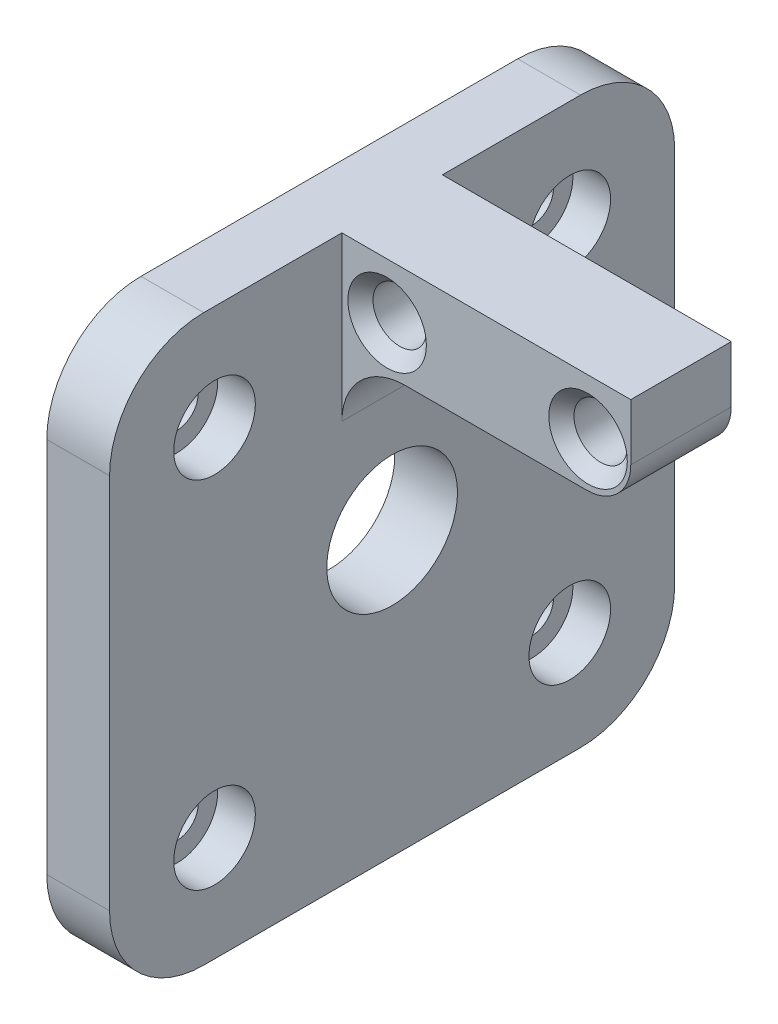
from build123d import *

# Parameters (mm, degrees)
SKETCH1_W                      = 45
SKETCH1_H                      = 45
SKETCH1_R                      = 5.205
BOSS_EXTRUDE1_DEPTH            = 5
SKETCH1_3_W                    = 8
SKETCH1_3_H                    = 8
BOSS_EXTRUDE2_DEPTH            = 28
FILLET1_R                      = 7.5
FILLET2_R                      = 5
FILLET3_R                      = 3.5
CUT_EXTRUDE1_DEPTH             = 43.385138905
CUT_EXTRUDE1_DEPTH_BACK        = 43.385138905
SKETCH2_R                      = 2.125
CBORE_FOR_M3_SHCS1_D           = 3.4
CBORE_FOR_M3_SHCS1_CBORE_D     = 6.5
CBORE_FOR_M3_SHCS1_CBORE_DEPTH = 3
CHAMFER1_SIZE                  = 1


with BuildPart() as part:
    # Sketch1 → Boss-Extrude1 (new body)
    with BuildSketch(Plane(origin=(0, 0, 0), x_dir=(0, 0, -1), z_dir=(1, 0, 0))):
        Rectangle(SKETCH1_W, SKETCH1_H)
        Circle(SKETCH1_R, mode=Mode.SUBTRACT)
    extrude(amount=BOSS_EXTRUDE1_DEPTH)

    # Sketch1<3> → Boss-Extrude2 (add)
    with BuildSketch(Plane(origin=(0, 0, 0), x_dir=(0, 0, -1), z_dir=(1, 0, 0))):
        with Locations((0, 18.5)):
            Rectangle(SKETCH1_3_W, SKETCH1_3_H)
    extrude(amount=BOSS_EXTRUDE2_DEPTH)

    # Fillet1
    fillet1_edges = [part.edges().sort_by_distance(p)[0] for p in [
        (2.5, -22.5, 22.5),
        (2.5, -22.5, -22.5),
        (2.5, 22.5, -22.5),
        (2.5, 22.5, 22.5),
    ]]
    fillet(fillet1_edges, radius=FILLET1_R)

    # Fillet2
    fillet2_edges = [part.edges().sort_by_distance(p)[0] for p in [
        (5, 14.5, 0),
    ]]
    fillet(fillet2_edges, radius=FILLET2_R)

    # Fillet3
    fillet3_edges = [part.edges().sort_by_distance(p)[0] for p in [
        (28, 14.5, 0),
    ]]
    fillet(fillet3_edges, radius=FILLET3_R)

    # Sketch2 → Cut-Extrude1 (cut, two sides: drawn at the far end of the back side and taken through both)
    with BuildSketch(Plane.XY.offset(-CUT_EXTRUDE1_DEPTH_BACK)):
        with Locations((8.6, 18.1)):
            Circle(SKETCH2_R)
        with Locations((24.6, 18.1)):
            Circle(SKETCH2_R)
    extrude(amount=CUT_EXTRUDE1_DEPTH + CUT_EXTRUDE1_DEPTH_BACK, mode=Mode.SUBTRACT)

    # CBORE for M3 SHCS1 (through all)
    with Locations(Plane(origin=(5, 0, 0), x_dir=(0, 0, -1), z_dir=(1, 0, 0))):
        with Locations((-14.142135624, 14.142135624), (14.142135624, 14.142135624), (-14.142135624, -14.142135624), (14.142135624, -14.142135624)):
            CounterBoreHole(CBORE_FOR_M3_SHCS1_D / 2, CBORE_FOR_M3_SHCS1_CBORE_D / 2, CBORE_FOR_M3_SHCS1_CBORE_DEPTH)

    # Chamfer1
    chamfer1_edges = [part.edges().sort_by_distance(p)[0] for p in [
        (22.475, 18.1, 4),
        (6.475, 18.1, 4),
    ]]
    chamfer(chamfer1_edges, length=CHAMFER1_SIZE)


solid = part.part
